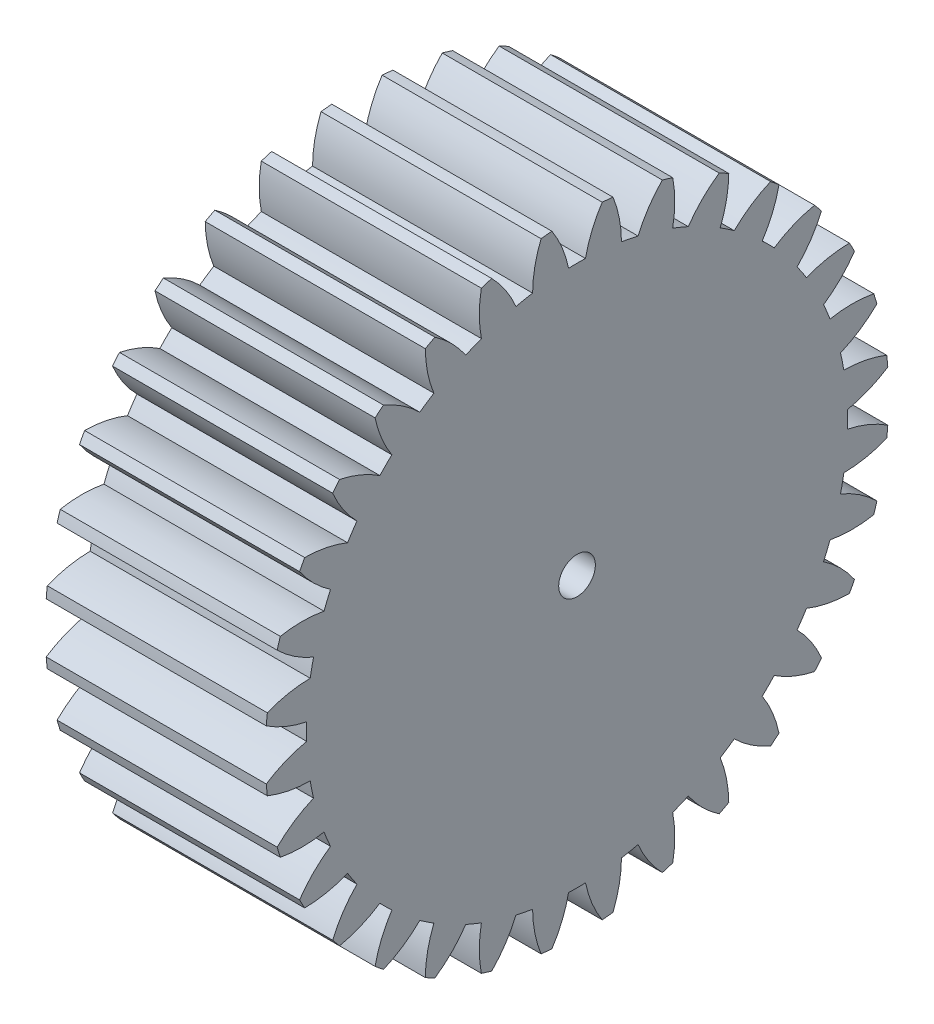
from build123d import *

# Parameters (mm, degrees)
BASPROSKE_W     = 6
BASPROSKE_H     = 8.5
TOOTHCUT_DEPTH  = 14.435028843
TEETHCUTS_COUNT = 32
TEETHCUTS_ANGLE = 348.75
BORSKE_R        = 0.5
BORE_DEPTH      = 50.0000508


with BuildPart() as part:
    # BasProSke → Base-Revolve (revolve)
    with BuildSketch(Plane(origin=(0, 0, 0), x_dir=(1, 0, 0), z_dir=(0, 1, 0)), mode=Mode.PRIVATE) as base_revolve_sk:
        with Locations((3, 4.25)):
            Rectangle(BASPROSKE_W, BASPROSKE_H)
    revolve(base_revolve_sk.sketch.rotate(Axis((-10, 0, 0), (1, 0, 0)), 180), axis=Axis((-10, 0, 0), (1, 0, 0)))

    # TooCutSke → ToothCut (cut, through all)
    with BuildSketch(Plane(origin=(0, 0, 0), x_dir=(0, 0, -1), z_dir=(1, 0, 0))):
        with BuildLine():
            ThreePointArc((0.230915662, 7.370383569), (0, 7.374), (-0.230915662, 7.370383569))
            ThreePointArc((-0.230915662, 7.370383569), (-0.411960263, 7.95607799), (-0.701370671, 8.496500712))
            ThreePointArc((-0.701370671, 8.496500712), (0, 8.5254), (0.701370671, 8.496500712))
            ThreePointArc((0.701370671, 8.496500712), (0.411960263, 7.95607799), (0.230915662, 7.370383569))
        make_face()
    toothcut = extrude(amount=TOOTHCUT_DEPTH, mode=Mode.SUBTRACT)

    # TeethCuts: ToothCut ×32 about axis
    teethcuts_axis = Axis((-10, 0, 0), (1, 0, 0))
    for i in range(1, TEETHCUTS_COUNT):
        add(toothcut.rotate(teethcuts_axis, i * TEETHCUTS_ANGLE / (TEETHCUTS_COUNT - 1)), mode=Mode.SUBTRACT)

    # BorSke → Bore (cut, symmetric)
    with BuildSketch(Plane(origin=(0, 0, 0), x_dir=(0, 0, -1), z_dir=(1, 0, 0))):
        with Locations(Location((0, 0, 0), (0, 0, 180))):
            Circle(BORSKE_R)
    extrude(amount=BORE_DEPTH, both=True, mode=Mode.SUBTRACT)


solid = part.part
